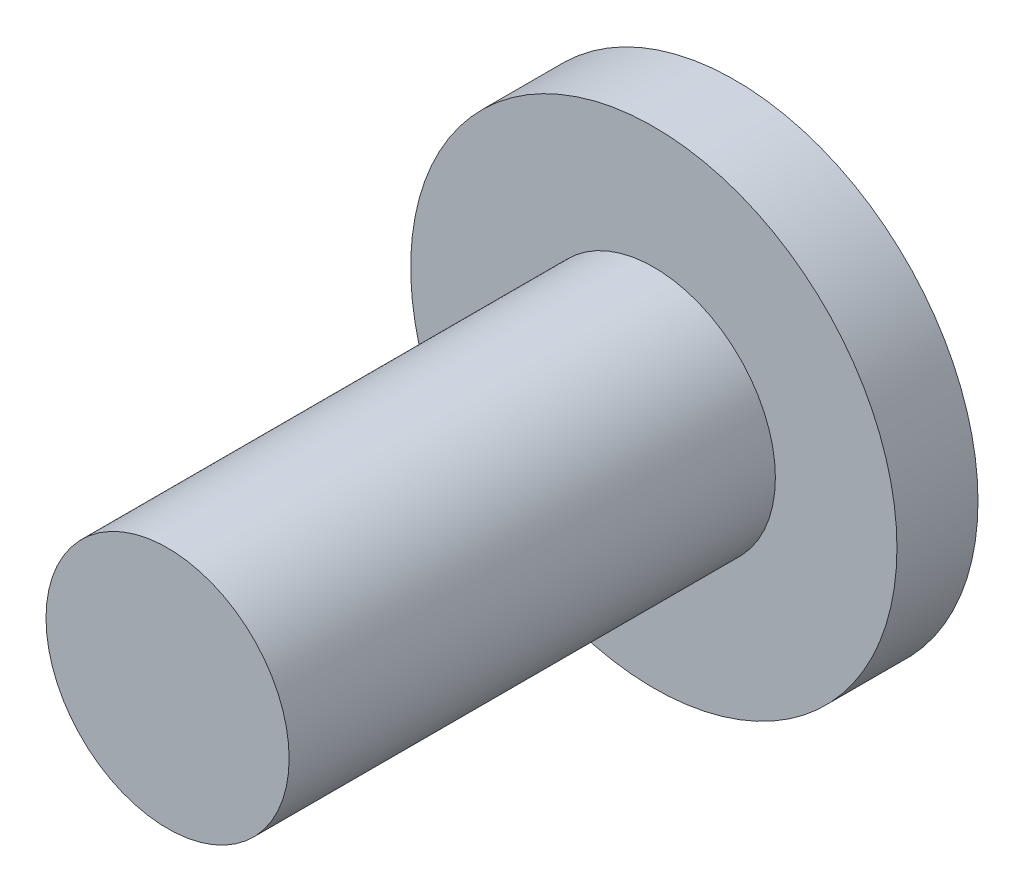
from build123d import *

# Parameters (mm, degrees)
SKETCH_1_R          = 3
EXTRUDE_1_DEPTH     = 1
CUT_EXTRUDE_1_DEPTH = 1
SKETCH_3_R          = 1.5
EXTRUDE_2_DEPTH     = 6


with BuildPart() as part:
    # 草图1 → 凸台-拉伸1 (new body)
    with BuildSketch(Plane.XY):
        Circle(SKETCH_1_R)
    extrude(amount=EXTRUDE_1_DEPTH)

    # 草图2 → 切除-拉伸1 (cut)
    with BuildSketch(Plane(origin=(0, 0, 0), x_dir=(-1, 0, 0), z_dir=(0, 0, -1))):
        Polygon((1.154700538, 0), (0.577350269, 1), (-0.577350269, 1), (-1.154700538, 0), (-0.577350269, -1), (0.577350269, -1), align=None)
    extrude(amount=-CUT_EXTRUDE_1_DEPTH, mode=Mode.SUBTRACT)

    # 草图3 → 凸台-拉伸2 (add)
    with BuildSketch(Plane.XY.offset(1)):
        Circle(SKETCH_3_R)
    extrude(amount=EXTRUDE_2_DEPTH)


solid = part.part
